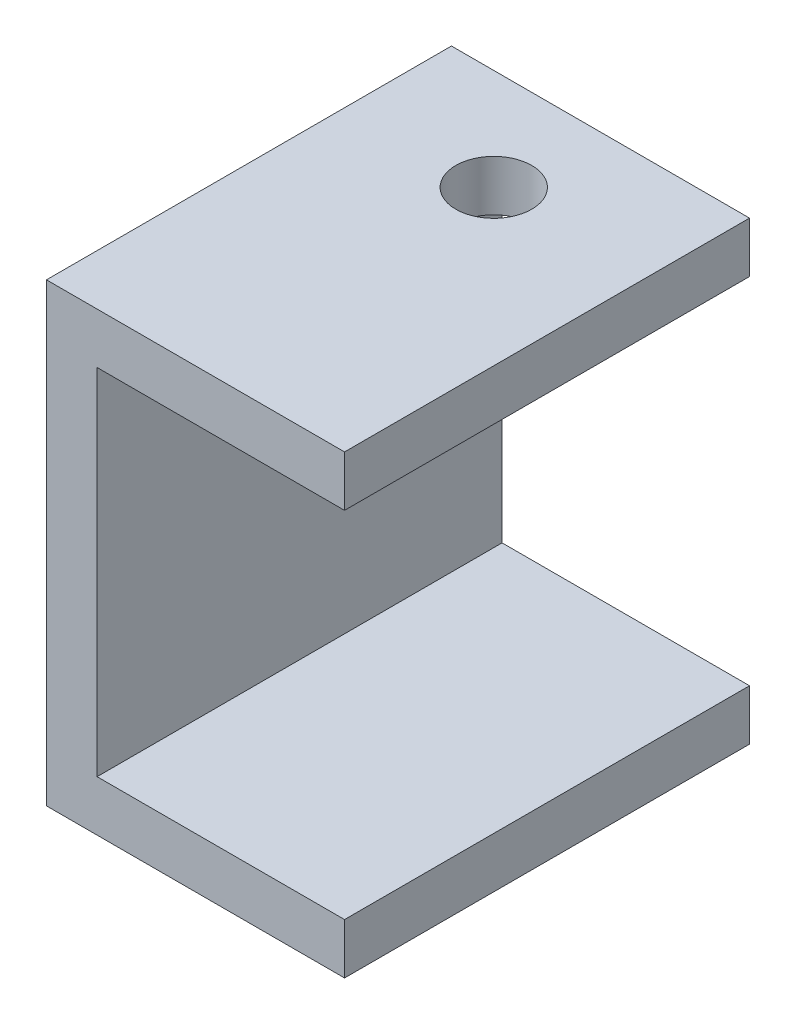
from build123d import *

# Parameters (mm, degrees)
BOSS_EXTRUDE1_DEPTH = 16
SKETCH3_R           = 1.5
CUT_EXTRUDE1_DEPTH  = 5


with BuildPart() as part:
    # Sketch2 → Boss-Extrude1 (new body)
    with BuildSketch(Plane.XY):
        Polygon((0, 0), (11.776283231, 0), (11.776283231, 2), (2, 2), (2, 16), (11.776283231, 16), (11.776283231, 18), (0, 18), align=None)
    extrude(amount=BOSS_EXTRUDE1_DEPTH)

    # Sketch3 → Cut-Extrude1 (cut)
    with BuildSketch(Plane(origin=(0, 18, 0), x_dir=(1, 0, 0), z_dir=(0, 1, 0))):
        with Locations(Location((5.671916194, -4, 0), (0, 0, 270))):
            Circle(SKETCH3_R)
    extrude(amount=-CUT_EXTRUDE1_DEPTH, mode=Mode.SUBTRACT)


solid = part.part
